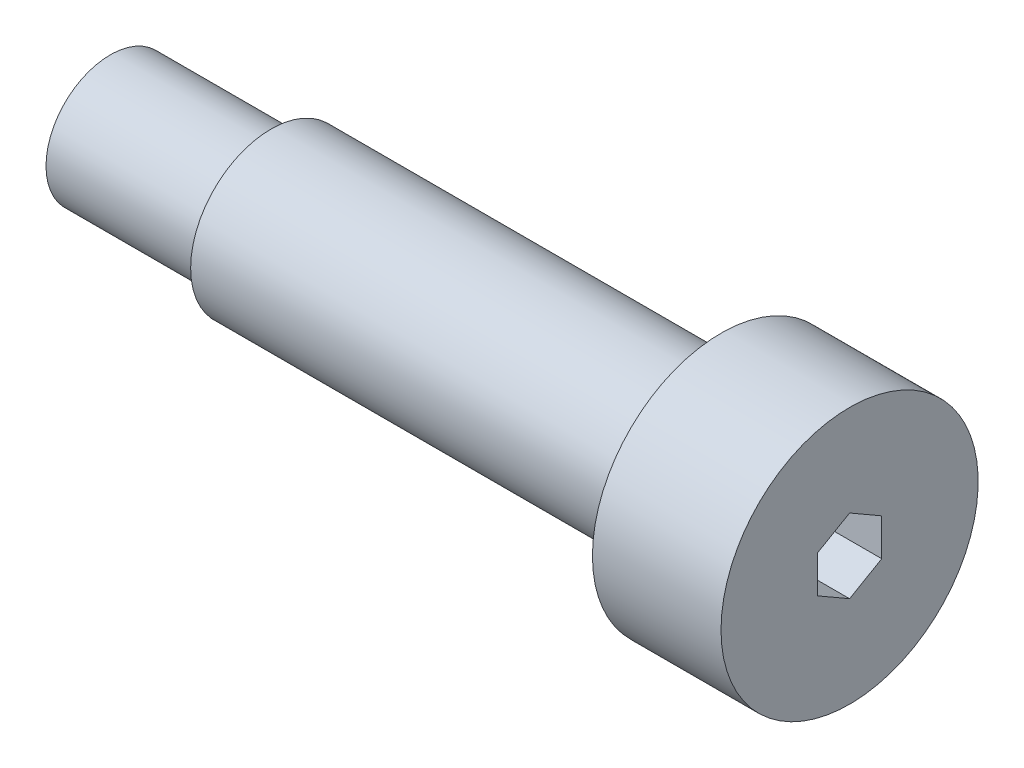
from build123d import *

# Parameters (mm, degrees)
CUT_EXTRUDE1_DEPTH = 2


with BuildPart() as part:
    # Sketch1 → Revolve1 (revolve)
    with BuildSketch(Plane.XY, mode=Mode.PRIVATE) as revolve1_sk:
        Polygon((18, 0), (18, 4), (14, 4), (14, 2.5), (0, 2.5), (0, 2), (-5, 2), (-5, 0), align=None)
    revolve(revolve1_sk.sketch.rotate(Axis((0, 0, 0), (1, 0, 0)), 90), axis=Axis((0, 0, 0), (1, 0, 0)))

    # Sketch2 → Cut-Extrude1 (cut)
    with BuildSketch(Plane(origin=(18, 0, 0), x_dir=(0, 0, -1), z_dir=(1, 0, 0))):
        Polygon((0, 1.154700538), (-1, 0.577350269), (-1, -0.577350269), (0, -1.154700538), (1, -0.577350269), (1, 0.577350269), align=None)
    extrude(amount=-CUT_EXTRUDE1_DEPTH, mode=Mode.SUBTRACT)


solid = part.part
